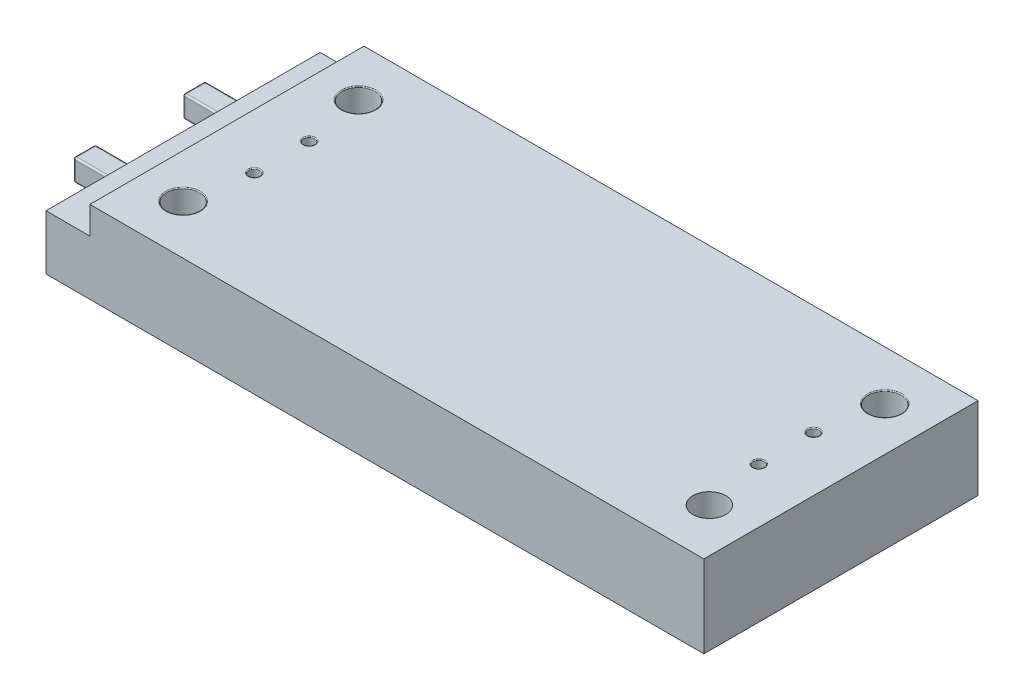
from build123d import *

# Parameters (mm, degrees)
SKETCH1_W           = 177.8
SKETCH1_H           = 79.375
BOSS_EXTRUDE1_DEPTH = 23.8125
SKETCH2_R           = 4.7625
CUT_EXTRUDE1_DEPTH  = 12.7
SKETCH3_R           = 3.571875
CUT_EXTRUDE2_DEPTH  = 11.1125
SKETCH4_R           = 2.778125
CUT_EXTRUDE3_DEPTH  = 18.7325
CUT_EXTRUDE4_REACH  = 197.612
SKETCH10_R          = 1.5875
FILLET1_R           = 0.254
SKETCH9_W           = 79.375
SKETCH9_H           = 15.875
BOSS_EXTRUDE3_DEPTH = 12.7
SKETCH11_W          = 6.35
SKETCH11_H          = 6.35
BOSS_EXTRUDE4_DEPTH = 12.7
FILLET2_R           = 0.508


with BuildPart() as part:
    # Sketch1 → Boss-Extrude1 (new body)
    with BuildSketch(Plane(origin=(0, 0, 0), x_dir=(1, 0, 0), z_dir=(0, 1, 0))):
        with Locations((88.9, 39.6875)):
            Rectangle(SKETCH1_W, SKETCH1_H)
    extrude(amount=BOSS_EXTRUDE1_DEPTH)

    # Sketch2 → Cut-Extrude1 (cut)
    with BuildSketch(Plane(origin=(0, 23.8125, 0), x_dir=(1, 0, 0), z_dir=(0, 1, 0))):
        with Locations(Location((12.7, 65.0875, 0), (0, 0, 270))):
            Circle(SKETCH2_R)
        with Locations(Location((12.7, 14.2875, 0), (0, 0, 270))):
            Circle(SKETCH2_R)
        with Locations(Location((165.1, 14.2875, 0), (0, 0, 90))):
            Circle(SKETCH2_R)
        with Locations(Location((165.1, 65.0875, 0), (0, 0, 90))):
            Circle(SKETCH2_R)
    extrude(amount=-CUT_EXTRUDE1_DEPTH, mode=Mode.SUBTRACT)

    # Sketch3 → Cut-Extrude2 (cut)
    with BuildSketch(Plane(origin=(0, 11.1125, 0), x_dir=(1, 0, 0), z_dir=(0, 1, 0))):
        with Locations(Location((12.7, 65.0875, 0), (0, 0, 270))):
            Circle(SKETCH3_R)
        with Locations(Location((12.7, 14.2875, 0), (0, 0, 90))):
            Circle(SKETCH3_R)
        with Locations(Location((165.1, 14.2875, 0), (0, 0, 270))):
            Circle(SKETCH3_R)
        with Locations(Location((165.1, 65.0875, 0), (0, 0, 90))):
            Circle(SKETCH3_R)
    extrude(amount=-CUT_EXTRUDE2_DEPTH, mode=Mode.SUBTRACT)

    # Sketch4 → Cut-Extrude3 (cut)
    with BuildSketch(Plane.XZ):
        with Locations(Location((15.875, -31.75, 0), (0, 0, 270))):
            Circle(SKETCH4_R)
        with Locations(Location((15.875, -47.625, 0), (0, 0, 270))):
            Circle(SKETCH4_R)
        with Locations(Location((161.925, -47.625, 0), (0, 0, 270))):
            Circle(SKETCH4_R)
        with Locations(Location((161.925, -31.75, 0), (0, 0, 270))):
            Circle(SKETCH4_R)
    extrude(amount=-CUT_EXTRUDE3_DEPTH, mode=Mode.SUBTRACT)

    # Sketch10 → Cut-Extrude4 (cut, up to next)
    with BuildSketch(Plane.XZ.offset(-18.7325), mode=Mode.PRIVATE) as cut_extrude4_sk1:
        with Locations(Location((15.875, -31.75, 0), (0, 0, 270))):
            Circle(SKETCH10_R)
    cut_extrude4_tool1 = extrude(cut_extrude4_sk1.sketch, amount=-CUT_EXTRUDE4_REACH, mode=Mode.PRIVATE) & part.part
    # Sketch10 → Cut-Extrude4 (cut, up to next)
    with BuildSketch(Plane.XZ.offset(-18.7325), mode=Mode.PRIVATE) as cut_extrude4_sk2:
        with Locations(Location((15.875, -47.625, 0), (0, 0, 270))):
            Circle(SKETCH10_R)
    cut_extrude4_tool2 = extrude(cut_extrude4_sk2.sketch, amount=-CUT_EXTRUDE4_REACH, mode=Mode.PRIVATE) & part.part
    # Sketch10 → Cut-Extrude4 (cut, up to next)
    with BuildSketch(Plane.XZ.offset(-18.7325), mode=Mode.PRIVATE) as cut_extrude4_sk3:
        with Locations(Location((161.925, -47.625, 0), (0, 0, 270))):
            Circle(SKETCH10_R)
    cut_extrude4_tool3 = extrude(cut_extrude4_sk3.sketch, amount=-CUT_EXTRUDE4_REACH, mode=Mode.PRIVATE) & part.part
    # Sketch10 → Cut-Extrude4 (cut, up to next)
    with BuildSketch(Plane.XZ.offset(-18.7325), mode=Mode.PRIVATE) as cut_extrude4_sk4:
        with Locations(Location((161.925, -31.75, 0), (0, 0, 270))):
            Circle(SKETCH10_R)
    cut_extrude4_tool4 = extrude(cut_extrude4_sk4.sketch, amount=-CUT_EXTRUDE4_REACH, mode=Mode.PRIVATE) & part.part
    add(cut_extrude4_tool1.solids().sort_by_distance((15.875, 18.7325, -31.75))[0], mode=Mode.SUBTRACT)
    add(cut_extrude4_tool2.solids().sort_by_distance((15.875, 18.7325, -47.625))[0], mode=Mode.SUBTRACT)
    add(cut_extrude4_tool3.solids().sort_by_distance((161.925, 18.7325, -47.625))[0], mode=Mode.SUBTRACT)
    add(cut_extrude4_tool4.solids().sort_by_distance((161.925, 18.7325, -31.75))[0], mode=Mode.SUBTRACT)

    # Fillet1
    fillet1_edges = [part.edges().sort_by_distance(p)[0] for p in [
        (12.7, 23.8125, -69.85),
        (12.7, 23.8125, -19.05),
        (165.1, 23.8125, -60.325),
        (12.7, 11.1125, -68.659375),
        (12.7, 11.1125, -10.715625),
        (165.1, 11.1125, -17.859375),
        (165.1, 11.1125, -61.515625),
        (15.875, 18.7325, -30.1625),
        (15.875, 23.8125, -30.1625),
        (15.875, 18.7325, -46.0375),
        (15.875, 23.8125, -46.0375),
        (161.925, 18.7325, -46.0375),
        (161.925, 23.8125, -46.0375),
        (161.925, 18.7325, -30.1625),
        (161.925, 23.8125, -30.1625),
    ]]
    fillet(fillet1_edges, radius=FILLET1_R)

    # Sketch9 → Boss-Extrude3 (add)
    with BuildSketch(Plane.ZY):
        with Locations((-39.6875, 7.9375)):
            Rectangle(SKETCH9_W, SKETCH9_H)
    extrude(amount=BOSS_EXTRUDE3_DEPTH)

    # Sketch11 → Boss-Extrude4 (add)
    with BuildSketch(Plane.ZY.offset(12.7)):
        with Locations((-55.5625, 9.525)):
            Rectangle(SKETCH11_W, SKETCH11_H)
        with Locations((-23.8125, 9.525)):
            Rectangle(SKETCH11_W, SKETCH11_H)
    extrude(amount=BOSS_EXTRUDE4_DEPTH)

    # Fillet2
    fillet2_edges = [part.edges().sort_by_distance(p)[0] for p in [
        (-19.05, 12.7, -26.9875),
        (-19.05, 6.35, -26.9875),
        (-19.05, 6.35, -20.6375),
        (-19.05, 12.7, -20.6375),
        (-25.4, 9.525, -26.9875),
        (-25.4, 6.35, -23.8125),
        (-25.4, 9.525, -20.6375),
        (-25.4, 12.7, -23.8125),
        (-19.05, 12.7, -52.3875),
        (-19.05, 12.7, -58.7375),
        (-19.05, 6.35, -58.7375),
        (-19.05, 6.35, -52.3875),
        (-25.4, 12.7, -55.5625),
        (-25.4, 9.525, -58.7375),
        (-25.4, 6.35, -55.5625),
        (-25.4, 9.525, -52.3875),
    ]]
    fillet(fillet2_edges, radius=FILLET2_R)


solid = part.part
